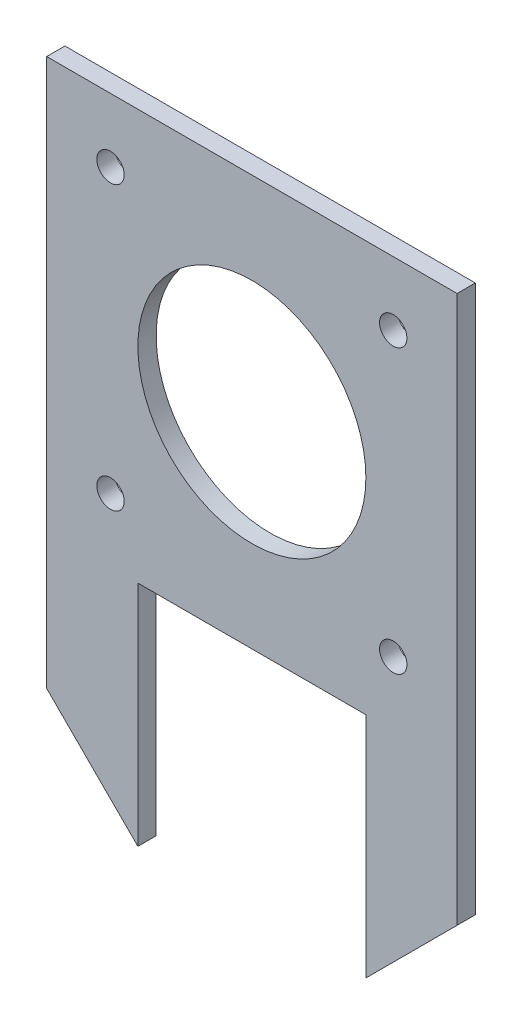
from build123d import *

# Parameters (mm, degrees)
ESQUISSE1_R        = 1.5
ESQUISSE1_R_2      = 12.5
BOSS_EXTRU_1_DEPTH = 2


with BuildPart() as part:
    # Esquisse1 → Boss.-Extru.1 (new body)
    with BuildSketch(Plane.XY):
        Polygon((-35, 10), (-35, 70), (10, 70), (10, 10), (0, 0), (0, 25), (-25, 25), (-25, 0), align=None)
        with Locations((-28, 32)):
            Circle(ESQUISSE1_R, mode=Mode.SUBTRACT)
        with Locations((3, 32)):
            Circle(ESQUISSE1_R, mode=Mode.SUBTRACT)
        with Locations((3, 63)):
            Circle(ESQUISSE1_R, mode=Mode.SUBTRACT)
        with Locations((-28, 63)):
            Circle(ESQUISSE1_R, mode=Mode.SUBTRACT)
        with Locations((-12.5, 47.5)):
            Circle(ESQUISSE1_R_2, mode=Mode.SUBTRACT)
    extrude(amount=BOSS_EXTRU_1_DEPTH)


solid = part.part
